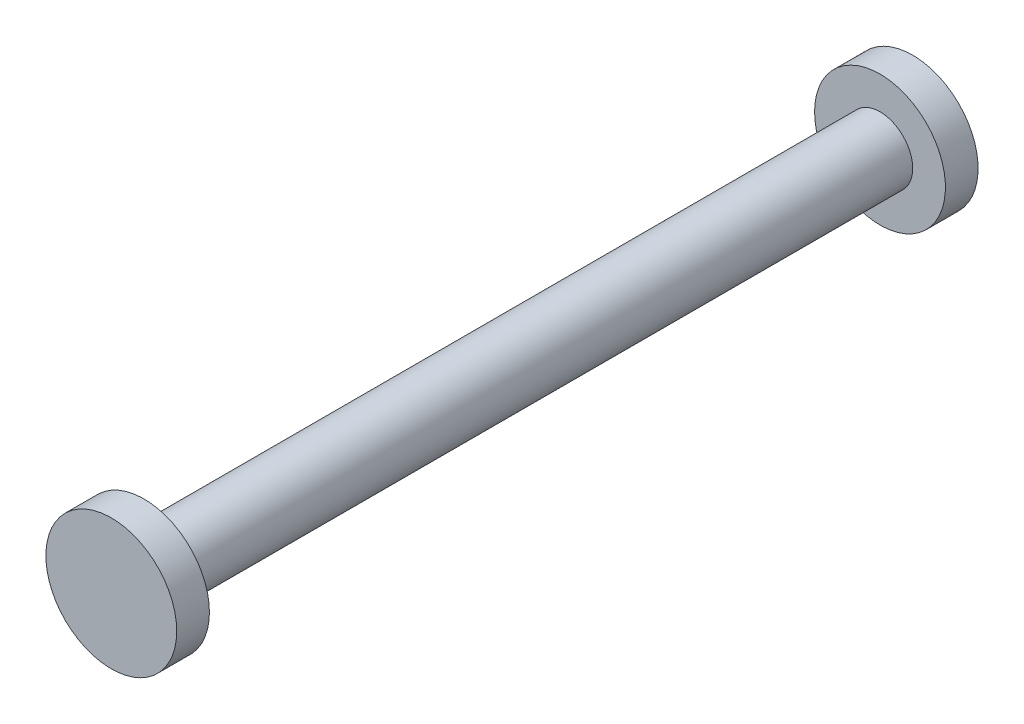
from build123d import *

# Parameters (mm, degrees)
SKETCH1_R           = 2.54
BOSS_EXTRUDE1_DEPTH = 57.15
SKETCH2_R           = 5.08
BOSS_EXTRUDE2_DEPTH = 2.54
BOSS_EXTRUDE3_START = 2.54
SKETCH3_R           = 5.08
BOSS_EXTRUDE3_DEPTH = 2.54


with BuildPart() as part:
    # Sketch1 → Boss-Extrude1 (new body)
    with BuildSketch(Plane.XY):
        Circle(SKETCH1_R)
    extrude(amount=BOSS_EXTRUDE1_DEPTH)

    # Sketch2 → Boss-Extrude2 (add)
    with BuildSketch(Plane.XY.offset(57.15)):
        Circle(SKETCH2_R)
    extrude(amount=BOSS_EXTRUDE2_DEPTH)

    # Sketch3 → Boss-Extrude3 (add)
    with BuildSketch(Plane(origin=(0, 0, 0), x_dir=(-1, 0, 0), z_dir=(0, 0, -1)).offset(BOSS_EXTRUDE3_START)):
        with Locations(Location((0, 0, 0), (0, 0, 180))):
            Circle(SKETCH3_R)
    extrude(amount=-BOSS_EXTRUDE3_DEPTH)


solid = part.part
